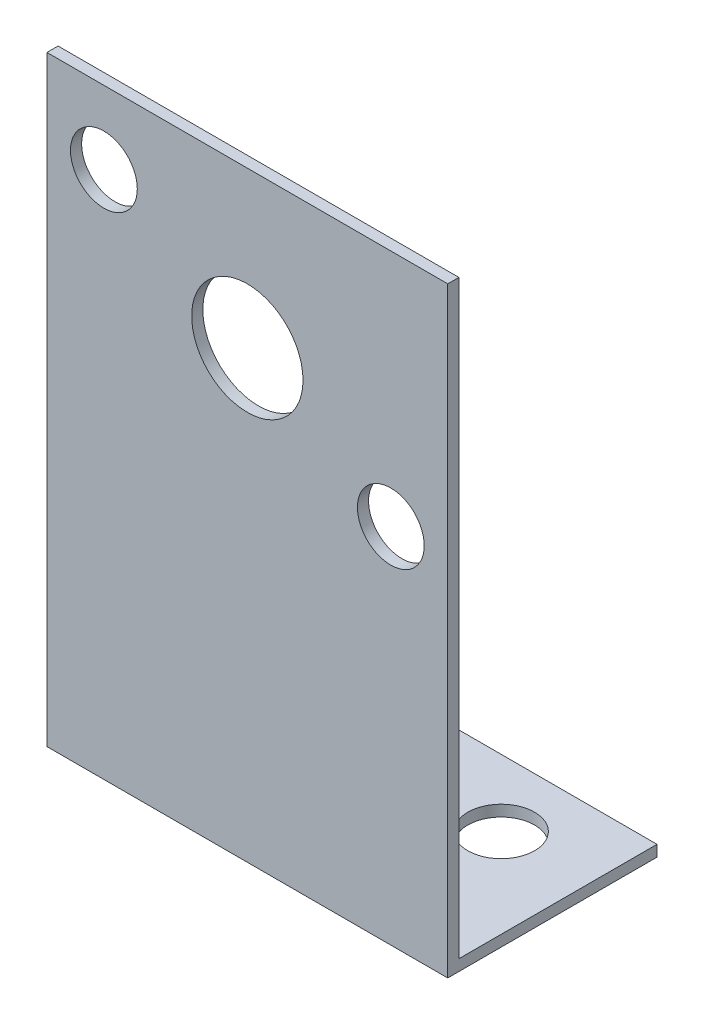
from build123d import *

# Parameters (mm, degrees)
SKETCH1_W      = 18
SKETCH1_H      = 27
SKETCH1_R      = 2.5
EXTRUDE1_DEPTH = 0.5
SKETCH2_W      = 18
SKETCH2_H      = 0.5
EXTRUDE2_DEPTH = 8.9
SKETCH3_R      = 1.5
EXTRUDE3_DEPTH = 0.5
SKETCH4_R      = 1.5
EXTRUDE4_DEPTH = 0.5


with BuildPart() as part:
    # Sketch1 → Extrude1 (new body)
    with BuildSketch(Plane.XY):
        with Locations((0, -6.5)):
            Rectangle(SKETCH1_W, SKETCH1_H)
        Circle(SKETCH1_R, mode=Mode.SUBTRACT)
    extrude(amount=EXTRUDE1_DEPTH)

    # Sketch2 → Extrude2 (add)
    with BuildSketch(Plane(origin=(0, 0, 0), x_dir=(-1, 0, 0), z_dir=(0, 0, -1))):
        with Locations((0, -19.75)):
            Rectangle(SKETCH2_W, SKETCH2_H)
    extrude(amount=EXTRUDE2_DEPTH)

    # Sketch3 → Extrude3 (cut)
    with BuildSketch(Plane(origin=(0, -19.5, 0), x_dir=(1, 0, 0), z_dir=(0, 1, 0))):
        with Locations(Location((-5, 5.9, 0), (0, 0, 180))):
            Circle(SKETCH3_R)
        with Locations(Location((5, 5.9, 0), (0, 0, 180))):
            Circle(SKETCH3_R)
    extrude(amount=-EXTRUDE3_DEPTH, mode=Mode.SUBTRACT)

    # Sketch4 → Extrude4 (cut)
    with BuildSketch(Plane(origin=(0, 0, 0), x_dir=(-1, 0, 0), z_dir=(0, 0, -1))):
        with Locations((-6.443229004, -3.72)):
            Circle(SKETCH4_R)
        with Locations((6.443229004, 3.72)):
            Circle(SKETCH4_R)
    extrude(amount=-EXTRUDE4_DEPTH, mode=Mode.SUBTRACT)


solid = part.part
